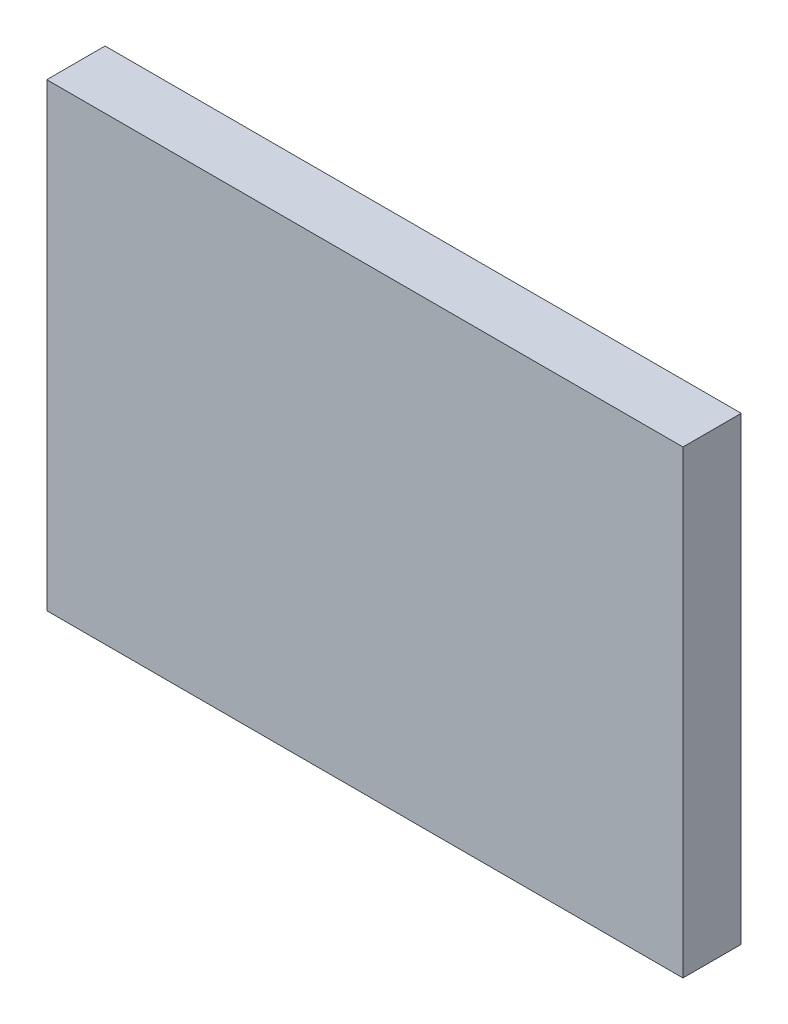
from build123d import *

# Parameters (mm, degrees)
SKIZZE1_W                       = 6.912
SKIZZE1_H                       = 3.888
AUFSATZ_LINEAR_AUSTRAGEN1_DEPTH = 1
SKIZZE2_W                       = 10.912
SKIZZE2_H                       = 7.888
AUFSATZ_LINEAR_AUSTRAGEN2_DEPTH = 1
AUFSATZ_LINEAR_AUSTRAGEN3_DEPTH = 0.0306
SCHNITT_LINEAR_AUSTRAGEN1_DEPTH = 10


with BuildPart() as part:
    # Skizze1 → Aufsatz-Linear austragen1 (new body)
    with BuildSketch(Plane.XY):
        with Locations((3.456, 1.944)):
            Rectangle(SKIZZE1_W, SKIZZE1_H)
    extrude(amount=AUFSATZ_LINEAR_AUSTRAGEN1_DEPTH)

    # Skizze2 → Aufsatz-Linear austragen2 (add)
    with BuildSketch(Plane.XY.offset(1)):
        with Locations((3.456, 1.944)):
            Rectangle(SKIZZE2_W, SKIZZE2_H)
    extrude(amount=AUFSATZ_LINEAR_AUSTRAGEN2_DEPTH)

    # Skizze3 → Aufsatz-Linear austragen3 (add)
    with BuildSketch(Plane(origin=(0, 0, 0), x_dir=(-1, 0, 0), z_dir=(0, 0, -1))):
        Polygon((-3.956, 1.944), (-3.461061255, 1.449061255), (-2.961061255, 1.949061255), (-3.456, 2.444), align=None)
    extrude(amount=AUFSATZ_LINEAR_AUSTRAGEN3_DEPTH)

    # Skizze4 → Schnitt-Linear austragen1 (cut)
    with BuildSketch(Plane(origin=(1.006, -1.006, 0), x_dir=(0, 0, -1), z_dir=(0.7071067811865474, -0.7071067811865477, 0))):
        Polygon((0.0153, 3.821955466), (0.0306, 3.471980924), (0.0306, 4.171930009), align=None)
    extrude(amount=-SCHNITT_LINEAR_AUSTRAGEN1_DEPTH, mode=Mode.SUBTRACT)


solid = part.part
